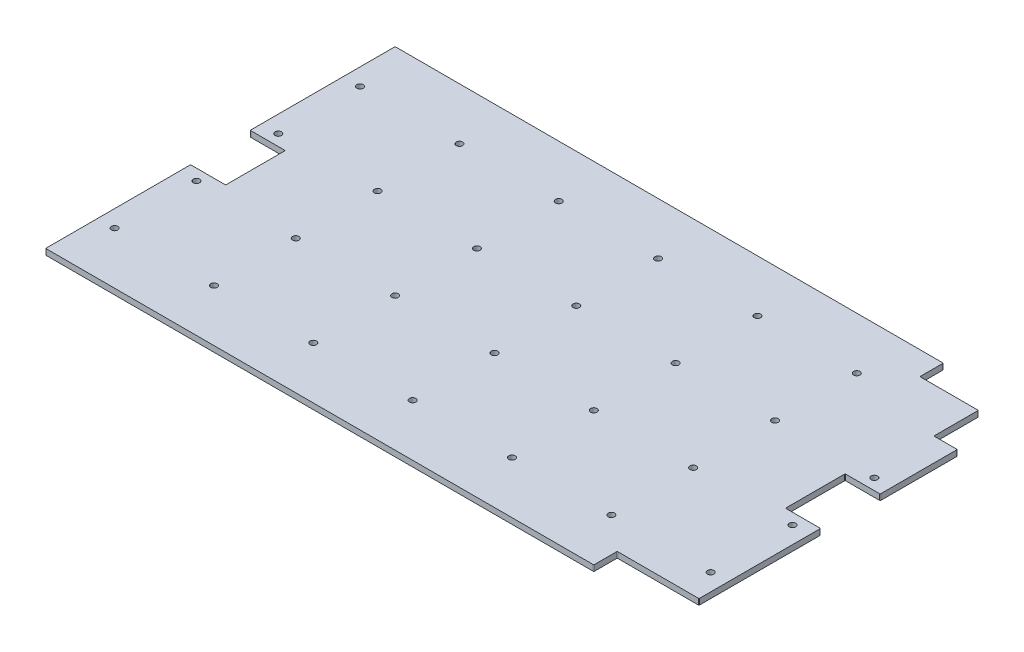
from build123d import *

# Parameters (mm, degrees)
SKETCH1_W                  = 539
SKETCH1_H                  = 299
BOSS_EXTRUDE1_DEPTH        = 5
SKETCH5_W                  = 70
SKETCH5_H                  = 20
CUT_EXTRUDE2_DEPTH         = 309.229622197
SKETCH2_W                  = 30
SKETCH2_H                  = 51
CUT_EXTRUDE1_DEPTH         = 309.229622197
F_5_5_5_5_DIAMETER_HOLE1_D = 5.5
LPATTERN1_COUNT            = 7
LPATTERN1_PITCH            = 85
LPATTERN1_COUNT_DIR2       = 4
LPATTERN1_PITCH_DIR2       = 70
FILLET1_R                  = 0.5


with BuildPart() as part:
    # Sketch1 → Boss-Extrude1 (new body)
    with BuildSketch(Plane(origin=(0, 0, 0), x_dir=(1, 0, 0), z_dir=(0, 1, 0))):
        Rectangle(SKETCH1_W, SKETCH1_H)
    extrude(amount=BOSS_EXTRUDE1_DEPTH)

    # Sketch5 → Cut-Extrude2 (cut, through all)
    with BuildSketch(Plane(origin=(0, 5, 0), x_dir=(1, 0, 0), z_dir=(0, 1, 0))):
        Polygon((269.5, 149.5), (199.5, 149.5), (199.5, 129.5), (249.5, 129.5), (249.5, 91.5), (269.5, 91.5), align=None)
        with Locations((234.5, -139.5)):
            Rectangle(SKETCH5_W, SKETCH5_H)
    extrude(amount=-CUT_EXTRUDE2_DEPTH, mode=Mode.SUBTRACT)

    # Sketch2 → Cut-Extrude1 (cut, through all)
    with BuildSketch(Plane(origin=(0, 5, 0), x_dir=(1, 0, 0), z_dir=(0, 1, 0))):
        with Locations((-254.5, 0)):
            Rectangle(SKETCH2_W, SKETCH2_H)
    cut_extrude1 = extrude(amount=-CUT_EXTRUDE1_DEPTH, mode=Mode.SUBTRACT)

    # Mirror1: Cut-Extrude1 across plane
    add(cut_extrude1.mirror(Plane(origin=(0, 0, 0), x_dir=(0, 0, 1), z_dir=(1, 0, 0))), mode=Mode.SUBTRACT)

    # Ø5.5 (5.5) Diameter Hole1 (through all)
    with Locations(Plane(origin=(-255, 5, 105), x_dir=(0, 0, 1), z_dir=(0, 1, 0))):
        with Locations((0, 0)):
            f_5_5_5_5_diameter_hole1 = Hole(F_5_5_5_5_DIAMETER_HOLE1_D / 2)

    # LPattern1: 5.5 _5.5_ Diameter Hole1 7 × 4, 1 skipped
    with Locations(*[(i * LPATTERN1_PITCH, 0, -j * LPATTERN1_PITCH_DIR2) for i in range(LPATTERN1_COUNT) for j in range(LPATTERN1_COUNT_DIR2) if (i, j) not in ((0, 0), (6, 3))]):
        add(f_5_5_5_5_diameter_hole1, mode=Mode.SUBTRACT)

    # Fillet1
    fillet1_edges = [part.edges().sort_by_distance(p)[0] for p in [
        (269.5, 2.5, -91.5),
        (249.5, 2.5, -91.5),
        (249.5, 2.5, -129.5),
        (199.5, 2.5, -129.5),
        (199.5, 2.5, -149.5),
        (269.5, 2.5, 129.5),
        (199.5, 2.5, 149.5),
        (199.5, 2.5, 129.5),
        (-269.5, 2.5, 25.5),
        (-269.5, 2.5, -25.5),
        (-239.5, 2.5, -25.5),
        (-239.5, 2.5, 25.5),
        (269.5, 2.5, -25.5),
        (269.5, 2.5, 25.5),
        (239.5, 2.5, 25.5),
        (239.5, 2.5, -25.5),
        (-269.5, 2.5, -149.5),
        (-269.5, 2.5, 149.5),
    ]]
    fillet(fillet1_edges, radius=FILLET1_R)


solid = part.part
